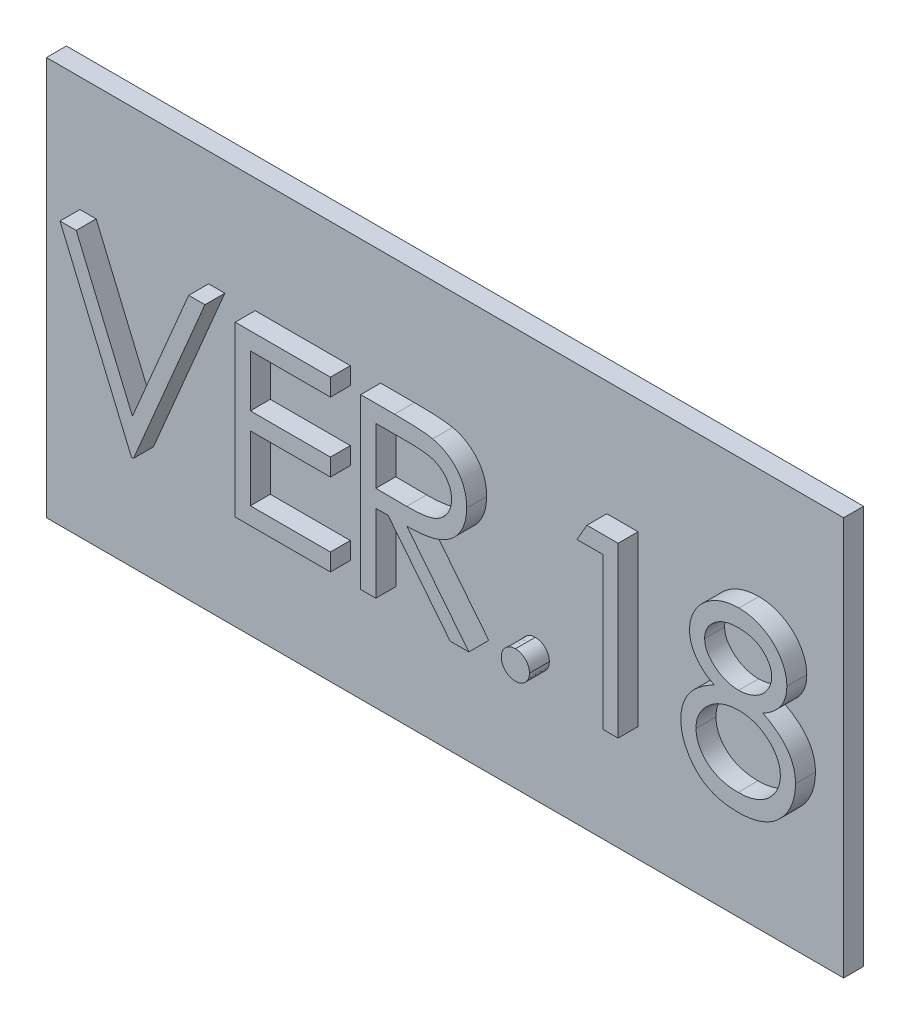
from build123d import *

# Parameters (mm, degrees)
SKETCH_1_W      = 20
SKETCH_1_H      = 10
EXTRUDE_1_DEPTH = 0.5
EXTRUDE_2_DEPTH = 0.5


with BuildPart() as part:
    # 스케치1 → 보스-돌출1 (new body)
    with BuildSketch(Plane.XY):
        Rectangle(SKETCH_1_W, SKETCH_1_H)
    extrude(amount=EXTRUDE_1_DEPTH)

    # 스케치2 → 보스-돌출2 (add)
    # profile 1 of 6: a face of its own
    with BuildSketch(Plane.XY.offset(0.5)):
        Polygon((-9.160199446, 2.117086085), (-8.753148164, 2.117086085), (-7.342885076, -1.216494311), (-5.931773965, 2.117086085), (-5.523874659, 2.117086085), (-7.3149003, -2.116247249), (-7.369173805, -2.116247249), align=None)
    # profile 2 of 6: a face of its own
    with BuildSketch(Plane.XY.offset(0.5)):
        Polygon((-4.764045599, 2.117086085), (-2.376011411, 2.117086085), (-2.376011411, 1.68289805), (-4.38413107, 1.68289805), (-4.38413107, 0.380333948), (-2.376011411, 0.380333948), (-2.376011411, -0.053854086), (-4.38413107, -0.053854086), (-4.38413107, -1.682059215), (-2.376011411, -1.682059215), (-2.376011411, -2.116247249), (-4.764045599, -2.116247249), align=None)
    # profile 3 of 6: a face of its own
    with BuildSketch(Plane.XY.offset(0.5)):
        with BuildLine():
            Line((-1.616182352, 2.117086085), (-0.769006871, 2.117086085))
            add(Edge.make_bspline(
                [(-0.769006871, 2.117086085), (-0.712472363, 2.1168979), (-0.603919845, 2.116536564), (-0.448407414, 2.114521784), (-0.307102258, 2.108747087), (-0.180078262, 2.103777657), (-0.067337756, 2.094715976), (0.031464967, 2.086055003), (0.115874849, 2.074717337), (0.166972212, 2.06418792), (0.190107713, 2.059420486)],
                knots=[0, 0, 0, 0, 1.410062039, 2.707475311, 3.878576406, 4.937260626, 5.877586885, 6.699081471, 7.410979367, 8, 8, 8, 8], degree=3))
            add(Edge.make_bspline(
                [(0.190107713, 2.059420486), (0.221079534, 2.051768113), (0.282362464, 2.036626612), (0.370597306, 2.004623095), (0.454676536, 1.96758793), (0.534250895, 1.924088954), (0.608921804, 1.873803268), (0.67945919, 1.817598968), (0.746183131, 1.755783585), (0.806395198, 1.686798587), (0.863169099, 1.614424903), (0.911052485, 1.536164169), (0.952329275, 1.45432594), (0.985192662, 1.368077921), (1.011654592, 1.27825654), (1.030312996, 1.184048186), (1.041502527, 1.085882054), (1.042641724, 1.018925345), (1.043219358, 0.984974706)],
                knots=[0, 0, 0, 0, 1.027469482, 2.033020251, 3.019912614, 3.986113645, 4.951240523, 5.91722682, 6.890402269, 7.87763091, 8.8651537, 9.85103654, 10.82876324, 11.815024772, 12.821070561, 13.842952187, 14.906261191, 16, 16, 16, 16], degree=3))
            add(Edge.make_bspline(
                [(1.043219358, 0.984974706), (1.04144257, 0.928568437), (1.037975596, 0.818505196), (1.005650946, 0.658774415), (0.952702204, 0.509774006), (0.879739749, 0.371691578), (0.786824764, 0.247218702), (0.675155731, 0.137889294), (0.544670354, 0.046401019), (0.423198705, -0.017041897), (0.315896768, -0.05767332), (0.227561237, -0.086262059), (0.131202131, -0.108350341), (0.027742688, -0.12813831), (-0.083247638, -0.143077978), (-0.201502828, -0.15402005), (-0.327107221, -0.160858756), (-0.413393524, -0.161877181), (-0.457782245, -0.162401095)],
                knots=[0, 0, 0, 0, 1.260483769, 2.459530307, 3.627416485, 4.787058657, 5.939039949, 7.08810263, 8.267026773, 9.491475466, 10.141966685, 10.831826277, 11.566392101, 12.351337768, 13.187381173, 14.07005841, 15.007169909, 16, 16, 16, 16], degree=3))
            Line((-0.457782245, -0.162401095), (1.097492862, -2.116247249))
            Line((1.097492862, -2.116247249), (0.627687841, -2.116247249))
            Line((0.627687841, -2.116247249), (-0.927587266, -0.162401095))
            Line((-0.927587266, -0.162401095), (-1.236267822, -0.162401095))
            Line((-1.236267822, -0.162401095), (-1.236267822, -2.116247249))
            Line((-1.236267822, -2.116247249), (-1.616182352, -2.116247249))
            Line((-1.616182352, -2.116247249), (-1.616182352, 2.117086085))
        make_face()
        with BuildLine():
            Line((-1.236267822, 1.68289805), (-1.236267822, 0.271786939))
            Line((-1.236267822, 0.271786939), (-0.461174339, 0.265850775))
            add(Edge.make_bspline(
                [(-0.461174339, 0.265850775), (-0.424985339, 0.265834765), (-0.354840751, 0.265803733), (-0.253360899, 0.2706343), (-0.158872764, 0.276129552), (-0.071737759, 0.284534951), (0.008083041, 0.295367533), (0.080549741, 0.308917809), (0.145780632, 0.324704589), (0.221857912, 0.349138937), (0.306810669, 0.387850978), (0.399135387, 0.444173057), (0.477757263, 0.515013801), (0.544181725, 0.596019791), (0.597557323, 0.685084587), (0.635188093, 0.781140577), (0.659067047, 0.881762795), (0.661883478, 0.950921078), (0.663304828, 0.98582273)],
                knots=[0, 0, 0, 0, 1.146690395, 2.22261258, 3.21895312, 4.145990853, 4.996080663, 5.770904154, 6.481378293, 7.121626537, 8.300444488, 9.431385265, 10.535395872, 11.636531494, 12.74115979, 13.810798291, 14.895190096, 16, 16, 16, 16], degree=3))
            add(Edge.make_bspline(
                [(0.663304828, 0.98582273), (0.661850834, 1.019866681), (0.658969548, 1.08732937), (0.6354458, 1.186094137), (0.59566531, 1.279308448), (0.542056508, 1.366593111), (0.476743244, 1.445823858), (0.400158842, 1.513614224), (0.31439732, 1.569554053), (0.234240728, 1.60530078), (0.162595538, 1.627217174), (0.100390139, 1.64264001), (0.030102923, 1.655030939), (-0.048607393, 1.664958784), (-0.135404794, 1.673491907), (-0.230728153, 1.679239297), (-0.333945021, 1.682642733), (-0.405484642, 1.682810964), (-0.442517822, 1.68289805)],
                knots=[0, 0, 0, 0, 1.101028733, 2.181837193, 3.264309656, 4.369019818, 5.486613113, 6.575447106, 7.666700264, 8.788928104, 9.402425223, 10.0903467, 10.862060571, 11.710948788, 12.657782767, 13.684531032, 14.801375019, 16, 16, 16, 16], degree=3))
            Line((-0.442517822, 1.68289805), (-1.236267822, 1.68289805))
        make_face(mode=Mode.SUBTRACT)
    # profile 4 of 6: a face of its own
    with BuildSketch(Plane.XY.offset(0.5)):
        with BuildLine():
            add(Edge.make_bspline(
                [(2.264373204, -1.464965197), (2.28794708, -1.466366028), (2.334160907, -1.469112191), (2.400973948, -1.487952549), (2.461443679, -1.521406358), (2.515306489, -1.565992766), (2.559703847, -1.620053234), (2.594349873, -1.680040667), (2.613026112, -1.747413069), (2.615752272, -1.793894676), (2.617150982, -1.817742975)],
                knots=[0, 0, 0, 0, 1.020151414, 1.999887582, 2.974338812, 3.990962822, 5.007586832, 5.987933904, 6.967670073, 8, 8, 8, 8], degree=3))
            add(Edge.make_bspline(
                [(2.617150982, -1.817742975), (2.615704874, -1.841018241), (2.612853171, -1.886916723), (2.594392683, -1.953780968), (2.559439804, -2.01380589), (2.515612717, -2.068599905), (2.461430364, -2.113280768), (2.400830988, -2.146449956), (2.334317752, -2.166639303), (2.287973246, -2.16921111), (2.264373204, -2.170520753)],
                knots=[0, 0, 0, 0, 1.009421747, 1.99056486, 2.972319754, 3.999869655, 5.017953583, 5.993804169, 6.978383603, 8, 8, 8, 8], degree=3))
            add(Edge.make_bspline(
                [(2.264373204, -2.170520753), (2.240756156, -2.169258497), (2.194649492, -2.166794244), (2.128384528, -2.146035421), (2.067416099, -2.113591807), (2.013244296, -2.068516593), (1.969050144, -2.014087848), (1.935636586, -1.95336758), (1.915570406, -1.887108127), (1.912931379, -1.84105594), (1.911595426, -1.817742975)],
                knots=[0, 0, 0, 0, 1.022052826, 1.995314843, 2.982371812, 4.00089066, 5.028879526, 6.005146991, 6.990147033, 8, 8, 8, 8], degree=3))
            add(Edge.make_bspline(
                [(1.911595426, -1.817742975), (1.912880061, -1.79385563), (1.915388151, -1.747218521), (1.935678712, -1.680453886), (1.968790892, -1.619773964), (2.013549798, -1.566075244), (2.067402994, -1.521096316), (2.128237452, -1.488360804), (2.194809087, -1.468959544), (2.240783012, -1.466319738), (2.264373204, -1.464965197)],
                knots=[0, 0, 0, 0, 1.032775665, 2.016367738, 2.991239715, 4.008302682, 5.025365648, 6.011011707, 6.979408107, 8, 8, 8, 8], degree=3))
        make_face()
    # profile 5 of 6: a face of its own
    with BuildSketch(Plane.XY.offset(0.5)):
        Polygon((4.059638963, 2.117086085), (4.842364657, 2.117086085), (4.842364657, -2.116247249), (4.462450127, -2.116247249), (4.462450127, 1.68289805), (3.811168076, 1.68289805), align=None)
    # profile 6 of 6: a face of its own
    with BuildSketch(Plane.XY.offset(0.5)):
        with BuildLine():
            add(Edge.make_bspline(
                [(8.474449326, 0.242106117), (8.509100426, 0.224038303), (8.576681643, 0.188800033), (8.672932171, 0.13206027), (8.760894791, 0.072260246), (8.843010042, 0.012224492), (8.917835238, -0.050346172), (8.984533718, -0.115700561), (9.04475303, -0.182207371), (9.097278759, -0.250992797), (9.143478743, -0.321874096), (9.183407706, -0.395037312), (9.217537085, -0.470322106), (9.244585592, -0.548550272), (9.266867187, -0.628572684), (9.282198634, -0.711422624), (9.290443858, -0.79655416), (9.292002708, -0.854089153), (9.292792007, -0.883221074)],
                knots=[0, 0, 0, 0, 1.272397273, 2.481599622, 3.635517121, 4.734568067, 5.792894095, 6.808321871, 7.773003508, 8.711915296, 9.623354172, 10.525449501, 11.423591555, 12.311487226, 13.218079475, 14.126165749, 15.051214107, 16, 16, 16, 16], degree=3))
            add(Edge.make_bspline(
                [(9.292792007, -0.883221074), (9.291858956, -0.923979283), (9.290012097, -1.004655074), (9.27392545, -1.12372799), (9.249840228, -1.239372717), (9.214667865, -1.351563901), (9.169052621, -1.459682476), (9.112837782, -1.563820993), (9.049203276, -1.665686252), (8.998098187, -1.728363052), (8.972239123, -1.760077377)],
                knots=[0, 0, 0, 0, 1.025265484, 2.029385089, 3.018602448, 3.995076438, 4.983346944, 5.966715145, 6.97116228, 8, 8, 8, 8], degree=3))
            add(Edge.make_bspline(
                [(8.972239123, -1.760077377), (8.938570244, -1.797081275), (8.871648543, -1.870631804), (8.757006335, -1.966124689), (8.63118939, -2.046375861), (8.49468455, -2.111777105), (8.347856703, -2.162680953), (8.190737136, -2.199259999), (8.023019541, -2.220211889), (7.907745305, -2.223240524), (7.84860798, -2.224794257)],
                knots=[0, 0, 0, 0, 0.954267603, 1.896743057, 2.838368354, 3.796610408, 4.779680527, 5.799409237, 6.871065594, 8, 8, 8, 8], degree=3))
            add(Edge.make_bspline(
                [(7.84860798, -2.224794257), (7.791744167, -2.223400308), (7.681092963, -2.220687824), (7.520035339, -2.202309797), (7.369905531, -2.170102758), (7.229830617, -2.126022135), (7.100655055, -2.068678335), (6.982746923, -1.99730626), (6.874405071, -1.914778706), (6.778917431, -1.818725488), (6.694143789, -1.715845966), (6.619675763, -1.609708305), (6.557779497, -1.500302815), (6.505374344, -1.389260828), (6.46525683, -1.275025956), (6.437471395, -1.15818594), (6.419825272, -1.038944863), (6.417477423, -0.958473244), (6.416296281, -0.917990037)],
                knots=[0, 0, 0, 0, 1.256902934, 2.445805442, 3.576955095, 4.645999104, 5.686449165, 6.692658513, 7.68621702, 8.689161843, 9.678783111, 10.630372946, 11.551080876, 12.453998257, 13.34127905, 14.221779781, 15.105423033, 16, 16, 16, 16], degree=3))
            add(Edge.make_bspline(
                [(6.416296281, -0.917990037), (6.416995242, -0.88828511), (6.418376635, -0.829577688), (6.427937737, -0.742843548), (6.443308924, -0.658423462), (6.464184648, -0.57600561), (6.492476651, -0.496190013), (6.526636184, -0.418598488), (6.566468164, -0.343143435), (6.61252824, -0.269412217), (6.666112593, -0.19843795), (6.726786722, -0.129016128), (6.795763287, -0.062223965), (6.872274931, 0.002754587), (6.955447279, 0.067072194), (7.047440673, 0.127252932), (7.145816406, 0.187557328), (7.215733421, 0.223611207), (7.251599433, 0.242106117)],
                knots=[0, 0, 0, 0, 0.941657376, 1.861047343, 2.762797495, 3.66048619, 4.553285746, 5.444104102, 6.34607688, 7.256116206, 8.197091036, 9.162375105, 10.176350973, 11.237807142, 12.343728897, 13.50695164, 14.721116704, 16, 16, 16, 16], degree=3))
            add(Edge.make_bspline(
                [(7.251599433, 0.242106117), (7.202503198, 0.268878646), (7.107439147, 0.320717757), (6.98156468, 0.415963894), (6.873444593, 0.519121537), (6.786050792, 0.632369003), (6.717262478, 0.752168556), (6.670068546, 0.877770652), (6.638141371, 1.006846332), (6.634978675, 1.095028112), (6.633390298, 1.139314984)],
                knots=[0, 0, 0, 0, 1.166880483, 2.259407225, 3.286803203, 4.280235371, 5.237608625, 6.161067461, 7.076446754, 8, 8, 8, 8], degree=3))
            add(Edge.make_bspline(
                [(6.633390298, 1.139314984), (6.635368382, 1.184427269), (6.639344677, 1.275110829), (6.671497836, 1.410101093), (6.723894488, 1.542684938), (6.795160837, 1.672219752), (6.883924422, 1.794321441), (6.990418816, 1.903832871), (7.112100898, 1.999761997), (7.248363271, 2.080287463), (7.395001385, 2.145823889), (7.549718498, 2.191033981), (7.709818923, 2.220590046), (7.81879426, 2.223936381), (7.874048685, 2.225633093)],
                knots=[0, 0, 0, 0, 0.888701115, 1.786444228, 2.72001202, 3.692817113, 4.693886446, 5.687152267, 6.695133018, 7.739871481, 8.800368666, 9.853104506, 10.91144658, 12, 12, 12, 12], degree=3))
            add(Edge.make_bspline(
                [(7.874048685, 2.225633093), (7.927877109, 2.223883707), (8.034020628, 2.220434116), (8.190042701, 2.191663321), (8.339328029, 2.143609521), (8.481361804, 2.078419546), (8.613601301, 1.99812296), (8.730444094, 1.900876189), (8.833655884, 1.791847837), (8.919029389, 1.669783174), (8.989378789, 1.540746101), (9.038365593, 1.405736005), (9.069755124, 1.26767), (9.073714335, 1.174248795), (9.07569799, 1.127442655)],
                knots=[0, 0, 0, 0, 1.072916533, 2.115669174, 3.151510826, 4.193348718, 5.225979165, 6.227137561, 7.216255879, 8.211077061, 9.189680878, 10.138522389, 11.067357538, 12, 12, 12, 12], degree=3))
            add(Edge.make_bspline(
                [(9.07569799, 1.127442655), (9.073962855, 1.081508976), (9.070555148, 0.991297841), (9.041889507, 0.859790526), (8.993613404, 0.736634345), (8.927701416, 0.620431822), (8.841794398, 0.513290392), (8.737039073, 0.413847614), (8.614270619, 0.321286593), (8.522031261, 0.269051657), (8.474449326, 0.242106117)],
                knots=[0, 0, 0, 0, 0.975232327, 1.915300861, 2.843280834, 3.77672583, 4.742871857, 5.749627742, 6.839139064, 8, 8, 8, 8], degree=3))
        make_face()
        with BuildLine():
            add(Edge.make_bspline(
                [(7.852848097, 1.791445059), (7.823153313, 1.790657126), (7.765057331, 1.789115585), (7.679872176, 1.781061805), (7.598867503, 1.765394581), (7.521196964, 1.744543949), (7.447925448, 1.716376573), (7.378057844, 1.683241657), (7.312783243, 1.642957177), (7.251313667, 1.597767919), (7.195977016, 1.548065071), (7.146864844, 1.496280858), (7.106069887, 1.441398241), (7.071427783, 1.384782416), (7.046292042, 1.324753052), (7.027466646, 1.263150582), (7.014740773, 1.199196546), (7.013787196, 1.155488576), (7.013304828, 1.13337882)],
                knots=[0, 0, 0, 0, 1.203892937, 2.355340988, 3.463153438, 4.544400666, 5.610487187, 6.640501085, 7.674077295, 8.714426146, 9.728707835, 10.68524104, 11.601827946, 12.495867327, 13.368432065, 14.231010473, 15.105153427, 16, 16, 16, 16], degree=3))
            add(Edge.make_bspline(
                [(7.013304828, 1.13337882), (7.014136215, 1.111268108), (7.015779154, 1.067574166), (7.028485356, 1.003051071), (7.047422695, 0.939645853), (7.077238257, 0.87886618), (7.112999471, 0.81860364), (7.157136781, 0.76036436), (7.209737795, 0.703945657), (7.269037652, 0.649827399), (7.333640178, 0.599149848), (7.402079926, 0.555155618), (7.473497942, 0.518344837), (7.547160445, 0.487708319), (7.623818186, 0.463892871), (7.703001444, 0.446997461), (7.784723528, 0.436496379), (7.840096231, 0.435242077), (7.86811252, 0.434607452)],
                knots=[0, 0, 0, 0, 0.873023192, 1.725219244, 2.590779336, 3.480155217, 4.391973325, 5.357036234, 6.360879153, 7.436073238, 8.526419356, 9.601555421, 10.645666583, 11.697338044, 12.750135903, 13.812665442, 14.89329948, 16, 16, 16, 16], degree=3))
            add(Edge.make_bspline(
                [(7.86811252, 0.434607452), (7.904095979, 0.435663206), (7.97570749, 0.437764285), (8.08127392, 0.457299515), (8.183917309, 0.488028577), (8.282540555, 0.530071584), (8.374590863, 0.582840519), (8.456645041, 0.646017598), (8.528003188, 0.718144039), (8.587923735, 0.798096993), (8.634381359, 0.883188914), (8.670548307, 0.968581649), (8.691668063, 1.055186252), (8.694422835, 1.113203437), (8.69578346, 1.141859055)],
                knots=[0, 0, 0, 0, 1.076279235, 2.141928126, 3.20205304, 4.278698113, 5.344010996, 6.36967002, 7.368914609, 8.37248503, 9.349703398, 10.264243087, 11.142681841, 12, 12, 12, 12], degree=3))
            add(Edge.make_bspline(
                [(8.69578346, 1.141859055), (8.695140118, 1.16197106), (8.693863174, 1.201890508), (8.68334025, 1.260840721), (8.665952337, 1.318449837), (8.642411279, 1.375193764), (8.611435622, 1.430276364), (8.574709414, 1.484563527), (8.530096732, 1.536834023), (8.48002676, 1.588305972), (8.42324517, 1.635941886), (8.359861391, 1.677833393), (8.290200378, 1.713408338), (8.214260486, 1.742302356), (8.132321388, 1.764004055), (8.044760482, 1.780255638), (7.950847675, 1.789415496), (7.886223119, 1.790753865), (7.852848097, 1.791445059)],
                knots=[0, 0, 0, 0, 0.814439003, 1.616544685, 2.417341072, 3.248991801, 4.09997495, 4.973547432, 5.9003056, 6.880240646, 7.880314356, 8.896779544, 9.951930927, 11.043077905, 12.18215768, 13.381699519, 14.647792085, 16, 16, 16, 16], degree=3))
        make_face(mode=Mode.SUBTRACT)
        with BuildLine():
            add(Edge.make_bspline(
                [(7.877440779, 0.000419418), (7.8397934, -0.000250225), (7.765938429, -0.0015639), (7.657738145, -0.016186438), (7.553896697, -0.03654199), (7.454764202, -0.067422147), (7.360382523, -0.107574092), (7.270240726, -0.155875869), (7.185028408, -0.212971977), (7.105922253, -0.278137026), (7.033685464, -0.348361318), (6.970308472, -0.422701233), (6.916487662, -0.499775154), (6.873146492, -0.580561946), (6.837572302, -0.663350961), (6.814211707, -0.750203957), (6.799235732, -0.839451227), (6.79722474, -0.900121061), (6.796210811, -0.93071039)],
                knots=[0, 0, 0, 0, 1.140299081, 2.23698856, 3.303958914, 4.344563908, 5.37730929, 6.408454204, 7.439741482, 8.480804886, 9.510774543, 10.48932336, 11.43758569, 12.353841022, 13.263987381, 14.161954604, 15.073269652, 16, 16, 16, 16], degree=3))
            add(Edge.make_bspline(
                [(6.796210811, -0.93071039), (6.797859705, -0.968726819), (6.801131072, -1.044150527), (6.827083387, -1.155623956), (6.868733987, -1.263538946), (6.92682163, -1.36701607), (6.998749074, -1.463717627), (7.087197279, -1.54800786), (7.18666953, -1.622903363), (7.300531506, -1.68347696), (7.424904984, -1.73185169), (7.559756884, -1.765181283), (7.703151881, -1.787244751), (7.802163007, -1.789468075), (7.852848097, -1.790606223)],
                knots=[0, 0, 0, 0, 0.898778495, 1.783155532, 2.693654817, 3.627872908, 4.583023416, 5.533784346, 6.509005473, 7.520592997, 8.575161974, 9.658835044, 10.801527049, 12, 12, 12, 12], degree=3))
            add(Edge.make_bspline(
                [(7.852848097, -1.790606223), (7.892460447, -1.789845664), (7.969638007, -1.788363852), (8.082227679, -1.775283706), (8.188477752, -1.754540826), (8.288182184, -1.724371014), (8.382457114, -1.687541042), (8.469704123, -1.640161477), (8.552167675, -1.586274381), (8.625784281, -1.522341182), (8.692832066, -1.454027889), (8.751292335, -1.381710408), (8.802040992, -1.307354167), (8.841871767, -1.229278819), (8.873713997, -1.148982265), (8.896602487, -1.065724075), (8.910725148, -0.979248889), (8.912153469, -0.920588107), (8.912877477, -0.890853285)],
                knots=[0, 0, 0, 0, 1.224942928, 2.386581632, 3.501229538, 4.569074225, 5.605009692, 6.626002462, 7.634866581, 8.645888296, 9.63523824, 10.59253846, 11.518950513, 12.414518923, 13.29783783, 14.186679152, 15.080837789, 16, 16, 16, 16], degree=3))
            add(Edge.make_bspline(
                [(8.912877477, -0.890853285), (8.911781832, -0.861973073), (8.909621411, -0.80502634), (8.895909413, -0.720642065), (8.871820685, -0.639116756), (8.838767548, -0.559469606), (8.794763907, -0.483314418), (8.742942017, -0.40866724), (8.68041675, -0.337599921), (8.609765324, -0.269560462), (8.532768295, -0.20664619), (8.450923272, -0.150990631), (8.364860256, -0.104119024), (8.274761363, -0.065999072), (8.180826653, -0.036018037), (8.083125216, -0.015073929), (7.981542663, -0.0018906), (7.912533439, -0.000359287), (7.877440779, 0.000419418)],
                knots=[0, 0, 0, 0, 0.917430815, 1.809013306, 2.70690318, 3.612392954, 4.541220862, 5.495268465, 6.494511384, 7.542276156, 8.608045339, 9.649016899, 10.681629292, 11.715607085, 12.752076957, 13.808767841, 14.885711793, 16, 16, 16, 16], degree=3))
        make_face(mode=Mode.SUBTRACT)
    extrude(amount=EXTRUDE_2_DEPTH)


solid = part.part
